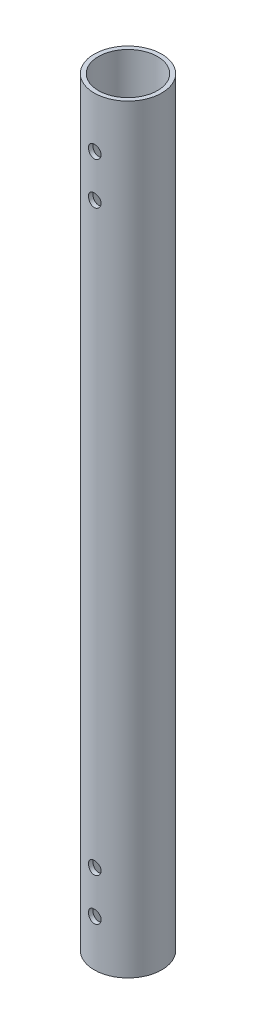
from build123d import *

# Parameters (mm, degrees)
IZIM1_R                     = 8
IZIM1_R_2                   = 7
Y_KSEKLIK_EKSTR_ZYON1_DEPTH = 180
IZIM2_R                     = 1.5
KES_EKSTR_ZYON1_DEPTH       = 10


with BuildPart() as part:
    # Çizim1 → Yükseklik-Ekstrüzyon1 (new body)
    with BuildSketch(Plane(origin=(0, 0, 0), x_dir=(1, 0, 0), z_dir=(0, 1, 0))):
        with Locations(Location((0, 0, 0), (0, 0, 90))):
            Circle(IZIM1_R)
        with Locations(Location((0, 0, 0), (0, 0, 90))):
            Circle(IZIM1_R_2, mode=Mode.SUBTRACT)
    extrude(amount=Y_KSEKLIK_EKSTR_ZYON1_DEPTH)

    # Çizim2 → Kes-Ekstrüzyon1 (cut, symmetric)
    with BuildSketch(Plane.XY):
        with Locations((0, 11)):
            Circle(IZIM2_R)
        with Locations((0, 168)):
            Circle(IZIM2_R)
        with Locations((0, 158)):
            Circle(IZIM2_R)
        with Locations((0, 21)):
            Circle(IZIM2_R)
    extrude(amount=KES_EKSTR_ZYON1_DEPTH, both=True, mode=Mode.SUBTRACT)


solid = part.part
